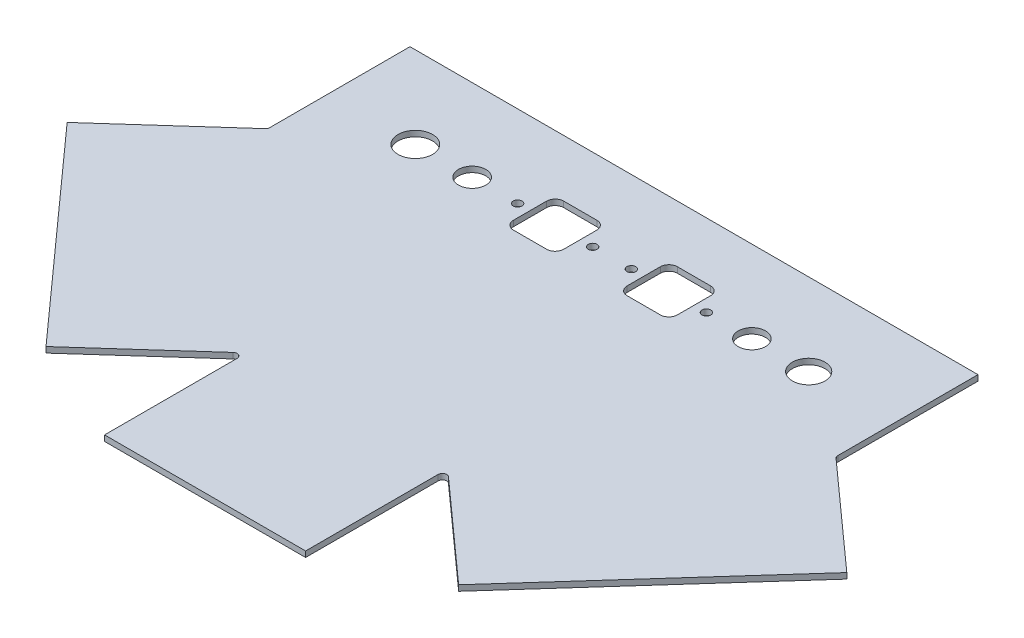
from build123d import *

# Parameters (mm, degrees)
BOSS_EXTRUDE1_DEPTH = 3.175
FILLET1_R           = 2.38125
SKETCH2_R           = 2.4511
SKETCH2_R_2         = 9.652
SKETCH2_R_3         = 7.62
SKETCH2_R_4         = 9.1186
CUT_EXTRUDE1_DEPTH  = 292.413808153


with BuildPart() as part:
    # Sketch1 → Boss-Extrude1 (new body)
    with BuildSketch(Plane(origin=(0, 0, 0), x_dir=(1, 0, 0), z_dir=(0, 1, 0))):
        Polygon((-158.623, 114.3), (-217.719823012, 61.309848699), (-115.230823012, -52.990151301), (-56.134, 0), (-56.134, -79.375), (56.134, -79.375), (56.134, 0), (115.230823012, -52.990151301), (217.719823012, 61.309848699), (158.623, 114.3), (158.623, 193.675), (-158.623, 193.675), align=None)
    extrude(amount=BOSS_EXTRUDE1_DEPTH)

    # Fillet1
    fillet1_edges = [part.edges().sort_by_distance(p)[0] for p in [
        (-56.134, 1.5875, 0),
        (-158.623, 1.5875, -114.3),
        (158.623, 1.5875, -114.3),
        (56.134, 1.5875, 0),
    ]]
    fillet(fillet1_edges, radius=FILLET1_R)

    # Sketch2 → Cut-Extrude1 (cut, through all)
    with BuildSketch(Plane(origin=(0, 3.175, 0), x_dir=(1, 0, 0), z_dir=(0, 1, 0))):
        with Locations(Location((52.705, 147.8915, 0), (0, 0, 270))):
            Circle(SKETCH2_R)
        with Locations(Location((10.795, 147.8915, 0), (0, 0, 270))):
            Circle(SKETCH2_R)
        with Locations(Location((-10.795, 147.8915, 0), (0, 0, 270))):
            Circle(SKETCH2_R)
        with Locations(Location((-52.705, 147.8915, 0), (0, 0, 270))):
            Circle(SKETCH2_R)
        with Locations(Location((-109.855, 147.8915, 0), (0, 0, 270))):
            Circle(SKETCH2_R_2)
        with Locations(Location((-78.105, 147.8915, 0), (0, 0, 270))):
            Circle(SKETCH2_R_3)
        with Locations(Location((78.105, 147.8915, 0), (0, 0, 270))):
            Circle(SKETCH2_R_3)
        with Locations(Location((109.855, 147.8915, 0), (0, 0, 270))):
            Circle(SKETCH2_R_4)
        with BuildLine():
            Line((17.7165, 157.1498), (17.7165, 138.6332))
            ThreePointArc((17.7165, 138.6332), (19.115123698, 135.256623698), (22.4917, 133.858))
            Line((22.4917, 133.858), (41.0083, 133.858))
            ThreePointArc((41.0083, 133.858), (44.384876302, 135.256623698), (45.7835, 138.6332))
            Line((45.7835, 138.6332), (45.7835, 157.1498))
            ThreePointArc((45.7835, 157.1498), (44.384876302, 160.526376302), (41.0083, 161.925))
            Line((41.0083, 161.925), (22.4917, 161.925))
            ThreePointArc((22.4917, 161.925), (19.115123698, 160.526376302), (17.7165, 157.1498))
        make_face()
        with BuildLine():
            Line((-45.7835, 157.1498), (-45.7835, 138.6332))
            ThreePointArc((-45.7835, 138.6332), (-44.384876302, 135.256623698), (-41.0083, 133.858))
            Line((-41.0083, 133.858), (-22.4917, 133.858))
            ThreePointArc((-22.4917, 133.858), (-19.115123698, 135.256623698), (-17.7165, 138.6332))
            Line((-17.7165, 138.6332), (-17.7165, 157.1498))
            ThreePointArc((-17.7165, 157.1498), (-19.115123698, 160.526376302), (-22.4917, 161.925))
            Line((-22.4917, 161.925), (-41.0083, 161.925))
            ThreePointArc((-41.0083, 161.925), (-44.384876302, 160.526376302), (-45.7835, 157.1498))
        make_face()
    extrude(amount=-CUT_EXTRUDE1_DEPTH, mode=Mode.SUBTRACT)


solid = part.part
